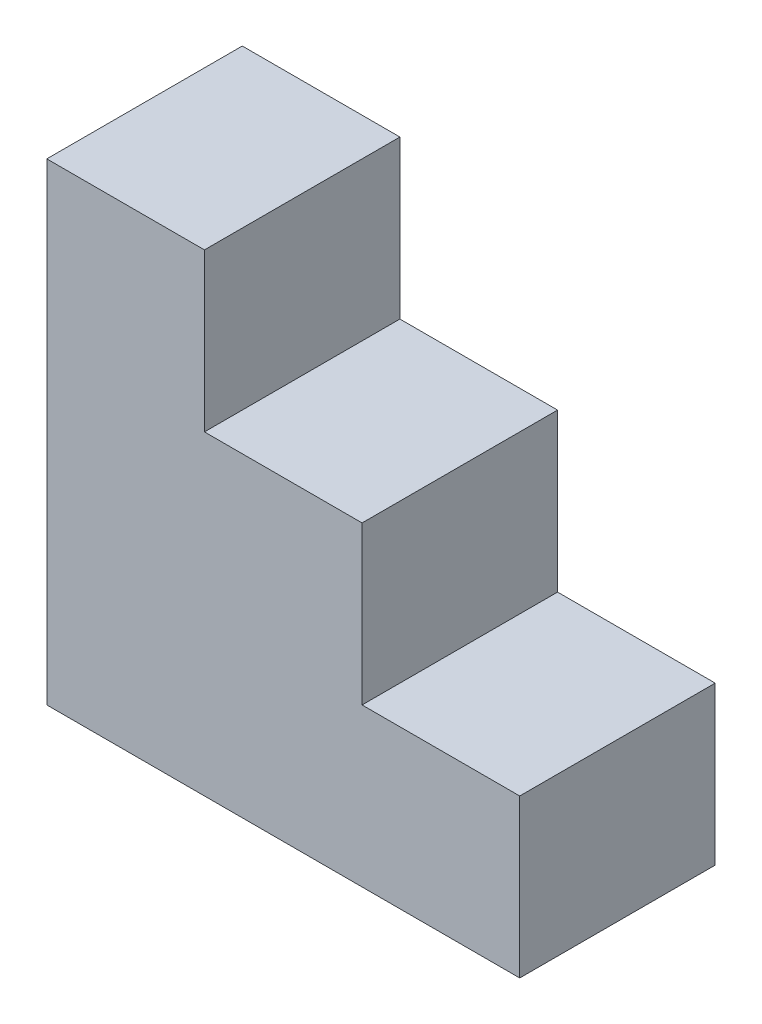
from build123d import *

# Parameters (mm, degrees)
BOSS_EXTRUDE1_DEPTH = 12.4


with BuildPart() as part:
    # Sketch1 → Boss-Extrude1 (new body)
    with BuildSketch(Plane.XY):
        Polygon((0, 0), (30, 0), (30, 10), (20, 10), (20, 20), (10, 20), (10, 30), (0, 30), align=None)
    extrude(amount=BOSS_EXTRUDE1_DEPTH)


solid = part.part
